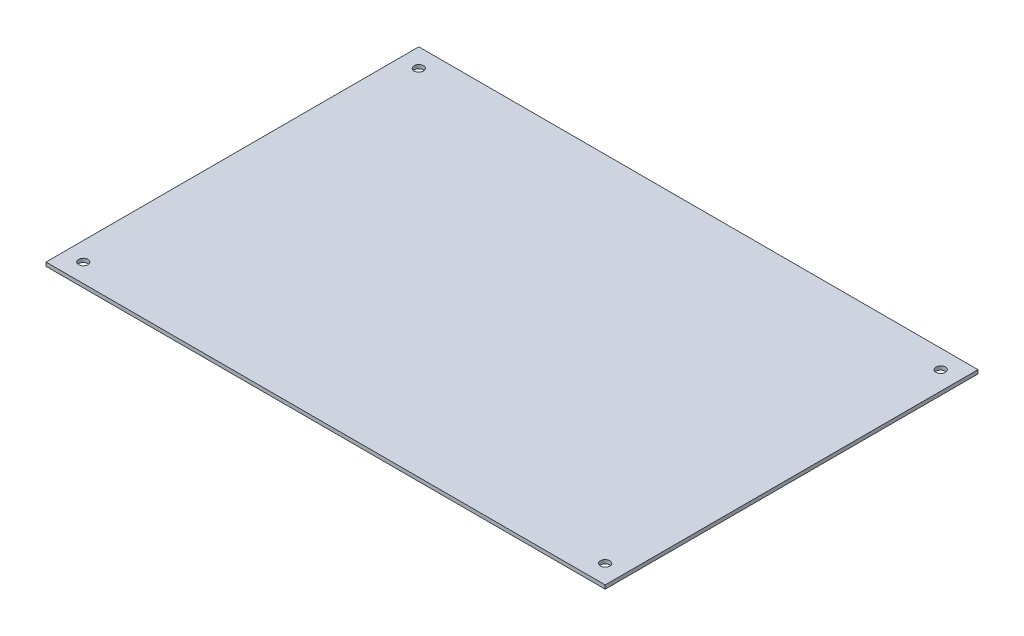
from build123d import *

# Parameters (mm, degrees)
ESBO_O1_R                = 2.5
RESSALTO_EXTRUS_O1_DEPTH = 2


with BuildPart() as part:
    # Esboço1 → Ressalto-extrusão1 (new body)
    with BuildSketch(Plane(origin=(0, 0, 0), x_dir=(1, 0, 0), z_dir=(0, 1, 0))):
        Polygon((-26.94457055, 34.735927746), (-36.94457055, 34.735927746), (-36.94457055, -165.264072254), (-26.94457055, -165.264072254), (253.05542945, -165.264072254), (263.05542945, -165.264072254), (263.05542945, 34.735927746), (253.05542945, 34.735927746), align=None)
        with Locations(Location((-26.94457055, -155.264072254, 0), (0, 0, 270))):
            Circle(ESBO_O1_R, mode=Mode.SUBTRACT)
        with Locations(Location((253.05542945, -155.264072254, 0), (0, 0, 270))):
            Circle(ESBO_O1_R, mode=Mode.SUBTRACT)
        with Locations(Location((-26.94457055, 24.735927746, 0), (0, 0, 270))):
            Circle(ESBO_O1_R, mode=Mode.SUBTRACT)
        with Locations(Location((253.05542945, 24.735927746, 0), (0, 0, 270))):
            Circle(ESBO_O1_R, mode=Mode.SUBTRACT)
    extrude(amount=RESSALTO_EXTRUS_O1_DEPTH)


solid = part.part
